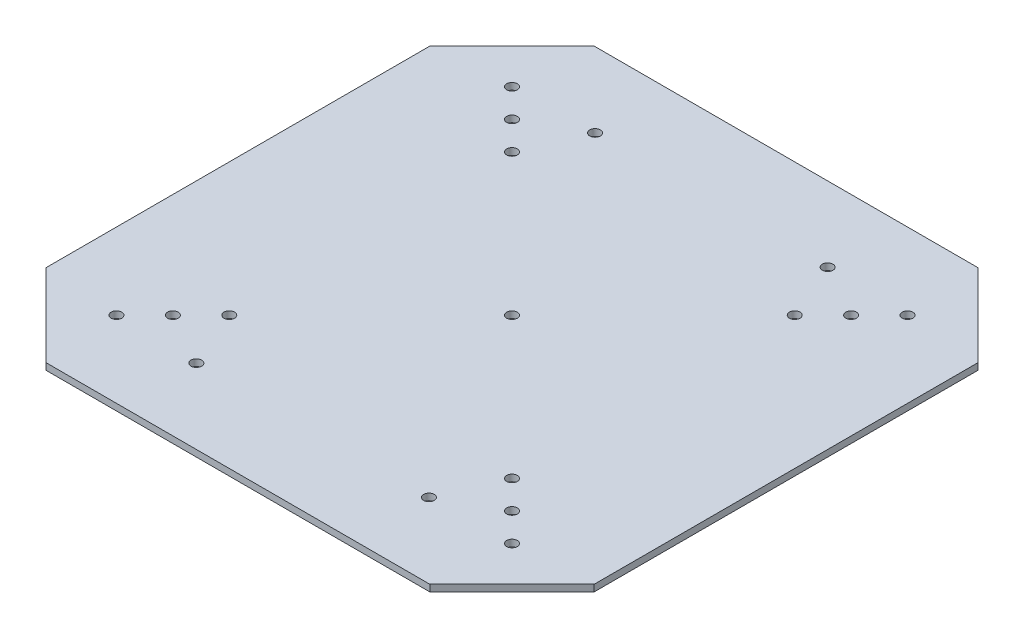
from build123d import *

# Parameters (mm, degrees)
BOSS_EXTRUDE1_DEPTH  = 2
M3_CLEARANCE_HOLE1_D = 3.2
M3_CLEARANCE_HOLE2_D = 3.2


with BuildPart() as part:
    # Sketch1 → Boss-Extrude1 (new body)
    with BuildSketch(Plane(origin=(0, 0, 0), x_dir=(1, 0, 0), z_dir=(0, 1, 0))):
        Polygon((-57.751262658, 82.5), (-82.5, 57.751262658), (-82.5, -57.751262658), (-57.751262658, -82.5), (57.751262658, -82.5), (82.5, -57.751262658), (82.5, 57.751262658), (57.751262658, 82.5), align=None)
    extrude(amount=BOSS_EXTRUDE1_DEPTH)

    # M3 Clearance Hole1 (through all)
    with Locations(Plane(origin=(0, 0, 0), x_dir=(-1, 0, 0), z_dir=(0, -1, 0))):
        with Locations((42.548466863, -42.548466863), (59.519029611, 59.519029611), (51.033748237, 51.033748237), (42.548466863, 42.548466863), (-59.519029611, -59.519029611), (-51.033748237, -51.033748237), (-42.548466863, -42.548466863), (-59.519029611, 59.519029611), (-51.033748237, 51.033748237), (-42.548466863, 42.548466863), (59.519029611, -59.519029611), (51.033748237, -51.033748237)):
            Hole(M3_CLEARANCE_HOLE1_D / 2)

    # M3 Clearance Hole2 (through all)
    with Locations(Plane(origin=(0, 2, 0), x_dir=(1, 0, 0), z_dir=(0, 1, 0))):
        with Locations((0, 0), (-35, 60), (35, -60), (35, 60), (-35, -60)):
            Hole(M3_CLEARANCE_HOLE2_D / 2)


solid = part.part
